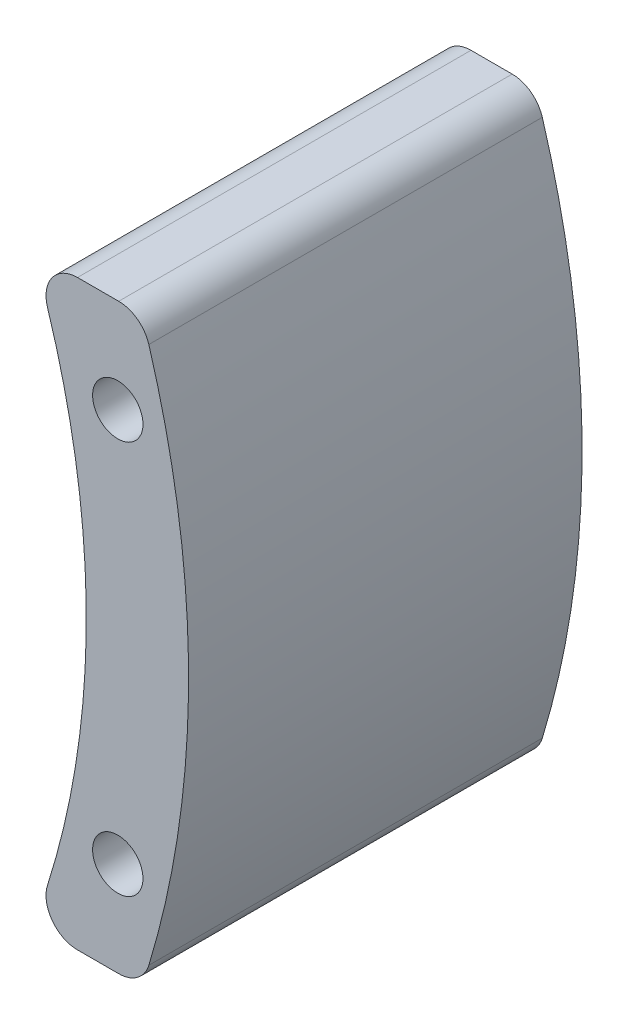
from build123d import *

# Parameters (mm, degrees)
SKETCH1_R           = 1.6
BOSS_EXTRUDE1_DEPTH = 25


with BuildPart() as part:
    # Sketch1 → Boss-Extrude1 (new body)
    with BuildSketch(Plane(origin=(0, 0, 0), x_dir=(0, 1, 0), z_dir=(0, 0, 1))):
        with BuildLine():
            Line((-18.5, -51.942275653), (-18.5, -54.559600438))
            ThreePointArc((-18.5, -54.559600438), (-18.105910137, -55.75167956), (-17.078947368, -56.473972384))
            ThreePointArc((-17.078947368, -56.473972384), (0, -59), (17.078947368, -56.473972384))
            ThreePointArc((17.078947368, -56.473972384), (18.105910137, -55.75167956), (18.5, -54.559600438))
            Line((18.5, -54.559600438), (18.5, -51.942275653))
            ThreePointArc((18.5, -51.942275653), (17.680887553, -50.328118106), (15.894495413, -50.036137097))
            ThreePointArc((15.894495413, -50.036137097), (0, -52.5), (-15.894495413, -50.036137097))
            ThreePointArc((-15.894495413, -50.036137097), (-17.680887553, -50.328118106), (-18.5, -51.942275653))
        make_face()
        with Locations(Location((-12.5, -54.5, 0), (0, 0, 270))):
            Circle(SKETCH1_R, mode=Mode.SUBTRACT)
        with Locations(Location((12.5, -54.5, 0), (0, 0, 270))):
            Circle(SKETCH1_R, mode=Mode.SUBTRACT)
    extrude(amount=BOSS_EXTRUDE1_DEPTH)


solid = part.part
